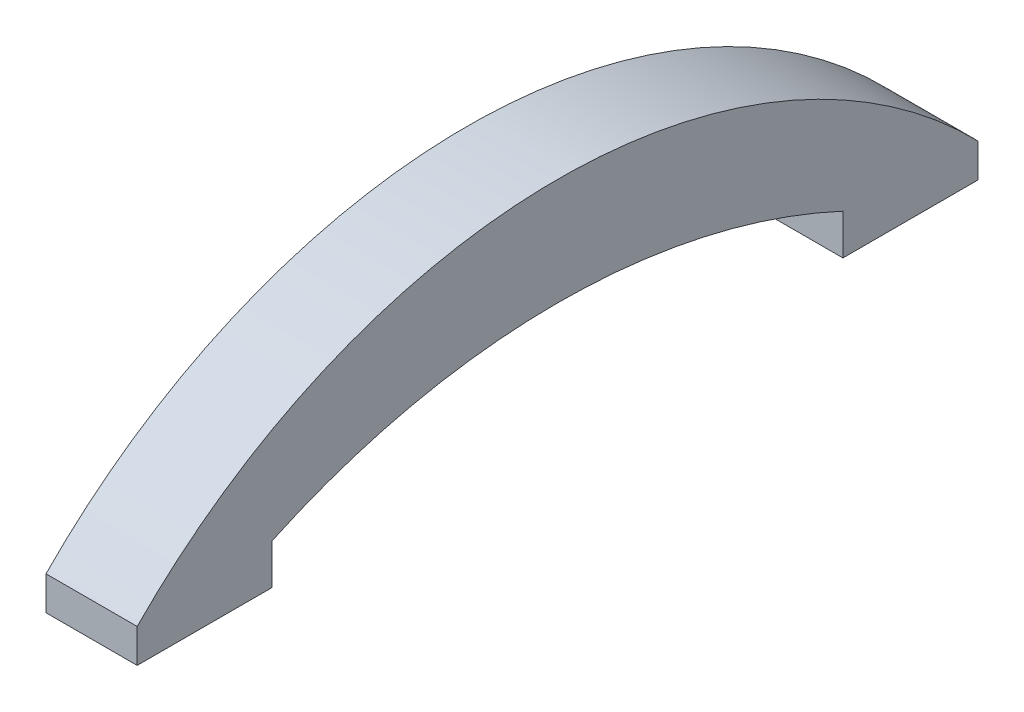
from build123d import *

# Parameters (mm, degrees)
BOSS_EXTRUDE1_DEPTH = 27
SKETCH3_W           = 23.5
SKETCH3_H           = 34.5
CUT_EXTRUDE1_DEPTH  = 7.5


with BuildPart() as part:
    # Sketch1 → Boss-Extrude1 (new body)
    with BuildSketch(Plane(origin=(0, 0, 0), x_dir=(0, 0, -1), z_dir=(1, 0, 0))):
        with BuildLine():
            Line((-124.5, 0), (-84.5, 0))
            Line((-84.5, 0), (-84.5, 12))
            ThreePointArc((-84.5, 12), (0, 30.7274152), (84.5, 12))
            Line((84.5, 12), (84.5, 0))
            Line((84.5, 0), (124.5, 0))
            Line((124.5, 0), (124.5, 10))
            ThreePointArc((124.5, 10), (0, 62.423059842), (-124.5, 10))
            Line((-124.5, 10), (-124.5, 0))
        make_face()
    extrude(amount=BOSS_EXTRUDE1_DEPTH)

    # Sketch3 → Cut-Extrude1 (cut)
    with BuildSketch(Plane.XZ):
        with Locations((13.5, 102.98)):
            Rectangle(SKETCH3_W, SKETCH3_H)
        with Locations((13.5, -104.5)):
            Rectangle(SKETCH3_W, SKETCH3_H)
    extrude(amount=-CUT_EXTRUDE1_DEPTH, mode=Mode.SUBTRACT)


solid = part.part
